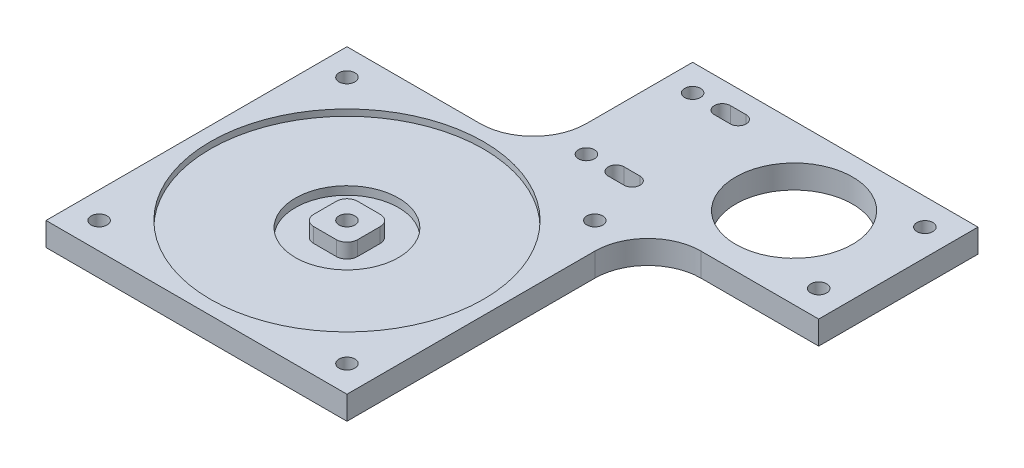
from build123d import *

# Parameters (mm, degrees)
BOSS_EXTRUDE3_DEPTH = 4.42
BOSS_EXTRUDE4_DEPTH = 4.42
SKETCH7_W           = 4.13
SKETCH7_H           = 4.13
BOSS_EXTRUDE5_DEPTH = 0.7
SKETCH7_3_R         = 25.72
SKETCH7_3_R_2       = 16.51
SKETCH7_3_R_3       = 9.715
CUT_EXTRUDE1_DEPTH  = 1.2
SKETCH7_4_R         = 9.715
CUT_EXTRUDE2_DEPTH  = 2.76
FILLET2_R           = 2
SKETCH8_R           = 1.5
CUT_EXTRUDE3_DEPTH  = 106.505366688
SKETCH9_R           = 1.5
CUT_EXTRUDE4_DEPTH  = 106.473714261
SKETCH10_R          = 1.5
CUT_EXTRUDE5_DEPTH  = 106.473714261
SKETCH11_R          = 11
CUT_EXTRUDE6_DEPTH  = 106.473714261
FILLET7_R           = 10
SKETCH12_W          = 8.26
SKETCH12_H          = 8.26
CUT_EXTRUDE7_DEPTH  = 0.7


with BuildPart() as part:
    # Sketch6 → Boss-Extrude3 (new body)
    with BuildSketch(Plane(origin=(0, 0, 0), x_dir=(1, 0, 0), z_dir=(0, 1, 0))):
        Polygon((0, 0), (35.09, 0), (56.68, 0), (56.68, -56.68), (35.09, -56.68), (0, -56.68), align=None)
    extrude(amount=BOSS_EXTRUDE3_DEPTH)

    # Sketch6<7> → Boss-Extrude4 (add)
    with BuildSketch(Plane(origin=(0, 0, 0), x_dir=(1, 0, 0), z_dir=(0, 1, 0))):
        Polygon((35.09, 0), (56.68, 0), (88.84, 0), (88.84, 30), (35.09, 30), align=None)
    extrude(amount=BOSS_EXTRUDE4_DEPTH)

    # Sketch7 → Boss-Extrude5 (add)
    with BuildSketch(Plane(origin=(0, 4.42, 0), x_dir=(1, 0, 0), z_dir=(0, 1, 0))):
        with Locations((26.275, -30.405)):
            Rectangle(SKETCH7_W, SKETCH7_H)
        with Locations((26.275, -26.275)):
            Rectangle(SKETCH7_W, SKETCH7_H)
        with Locations((30.405, -26.275)):
            Rectangle(SKETCH7_W, SKETCH7_H)
        with Locations((30.405, -30.405)):
            Rectangle(SKETCH7_W, SKETCH7_H)
    extrude(amount=BOSS_EXTRUDE5_DEPTH)

    # Sketch7<3> → Cut-Extrude1 (cut)
    # profile 1 of 2: a face of its own
    with BuildSketch(Plane(origin=(0, 4.42, 0), x_dir=(1, 0, 0), z_dir=(0, 1, 0))):
        with Locations(Location((28.34, -28.34, 0), (0, 0, 270))):
            Circle(SKETCH7_3_R)
        with Locations((28.34, -28.34)):
            Circle(SKETCH7_3_R_2, mode=Mode.SUBTRACT)
    # profile 2 of 2: a face of its own
    with BuildSketch(Plane(origin=(0, 4.42, 0), x_dir=(1, 0, 0), z_dir=(0, 1, 0))):
        with Locations((28.34, -28.34)):
            Circle(SKETCH7_3_R_2)
        with Locations(Location((28.34, -28.34, 0), (0, 0, 270))):
            Circle(SKETCH7_3_R_3, mode=Mode.SUBTRACT)
    extrude(amount=-CUT_EXTRUDE1_DEPTH, mode=Mode.SUBTRACT)

    # Sketch7<4> → Cut-Extrude2 (cut)
    with BuildSketch(Plane(origin=(0, 4.42, 0), x_dir=(1, 0, 0), z_dir=(0, 1, 0))):
        with Locations(Location((28.34, -28.34, 0), (0, 0, 270))):
            Circle(SKETCH7_4_R)
        Polygon((24.21, -28.34), (24.21, -32.47), (28.34, -32.47), (32.47, -32.47), (32.47, -28.34), (32.47, -24.21), (28.34, -24.21), (24.21, -24.21), align=None, mode=Mode.SUBTRACT)
    extrude(amount=-CUT_EXTRUDE2_DEPTH, mode=Mode.SUBTRACT)

    # Fillet2
    fillet2_edges = [part.edges().sort_by_distance(p)[0] for p in [
        (32.47, 3.39, 32.47),
        (32.47, 3.39, 24.21),
        (24.21, 3.39, 24.21),
        (24.21, 3.39, 32.47),
    ]]
    fillet(fillet2_edges, radius=FILLET2_R)

    # Sketch8 → Cut-Extrude3 (cut, through all)
    with BuildSketch(Plane(origin=(0, 5.12, 0), x_dir=(1, 0, 0), z_dir=(0, 1, 0))):
        with Locations(Location((28.34, -28.34, 0), (0, 0, 270))):
            Circle(SKETCH8_R)
    extrude(amount=-CUT_EXTRUDE3_DEPTH, mode=Mode.SUBTRACT)

    # Sketch9 → Cut-Extrude4 (cut, through all)
    with BuildSketch(Plane(origin=(0, 4.42, 0), x_dir=(1, 0, 0), z_dir=(0, 1, 0))):
        with Locations(Location((5, -5, 0), (0, 0, 270))):
            Circle(SKETCH9_R)
        with Locations(Location((51.68, -5, 0), (0, 0, 270))):
            Circle(SKETCH9_R)
        with Locations(Location((51.68, -51.68, 0), (0, 0, 270))):
            Circle(SKETCH9_R)
        with Locations(Location((5, -51.68, 0), (0, 0, 270))):
            Circle(SKETCH9_R)
    extrude(amount=-CUT_EXTRUDE4_DEPTH, mode=Mode.SUBTRACT)

    # Sketch10 → Cut-Extrude5 (cut, through all)
    with BuildSketch(Plane(origin=(0, 4.42, 0), x_dir=(1, 0, 0), z_dir=(0, 1, 0))):
        with Locations(Location((40.09, 25, 0), (0, 0, 270))):
            Circle(SKETCH10_R)
        with Locations(Location((40.09, 5, 0), (0, 0, 270))):
            Circle(SKETCH10_R)
        with Locations(Location((83.84, 5, 0), (0, 0, 270))):
            Circle(SKETCH10_R)
        with Locations(Location((83.84, 25, 0), (0, 0, 270))):
            Circle(SKETCH10_R)
        with BuildLine():
            Line((45.69, 26.5), (48.69, 26.5))
            ThreePointArc((48.69, 26.5), (50.19, 25), (48.69, 23.5))
            Line((48.69, 23.5), (45.69, 23.5))
            ThreePointArc((45.69, 23.5), (44.19, 25), (45.69, 26.5))
        make_face()
        with BuildLine():
            Line((45.69, 6.5), (48.69, 6.5))
            ThreePointArc((48.69, 6.5), (50.19, 5), (48.69, 3.5))
            Line((48.69, 3.5), (45.69, 3.5))
            ThreePointArc((45.69, 3.5), (44.19, 5), (45.69, 6.5))
        make_face()
    extrude(amount=-CUT_EXTRUDE5_DEPTH, mode=Mode.SUBTRACT)

    # Sketch11 → Cut-Extrude6 (cut, through all)
    with BuildSketch(Plane(origin=(0, 4.42, 0), x_dir=(1, 0, 0), z_dir=(0, 1, 0))):
        with Locations(Location((68.84, 15.364869593, 0), (0, 0, 270))):
            Circle(SKETCH11_R)
    extrude(amount=-CUT_EXTRUDE6_DEPTH, mode=Mode.SUBTRACT)

    # Fillet7
    fillet7_edges = [part.edges().sort_by_distance(p)[0] for p in [
        (35.09, 2.21, 0),
        (56.68, 2.21, 0),
    ]]
    fillet(fillet7_edges, radius=FILLET7_R)

    # Sketch12 → Cut-Extrude7 (cut)
    with BuildSketch(Plane(origin=(0, 5.12, 0), x_dir=(1, 0, 0), z_dir=(0, 1, 0))):
        with Locations((28.34, -28.34)):
            Rectangle(SKETCH12_W, SKETCH12_H)
    extrude(amount=-CUT_EXTRUDE7_DEPTH, mode=Mode.SUBTRACT)


solid = part.part
